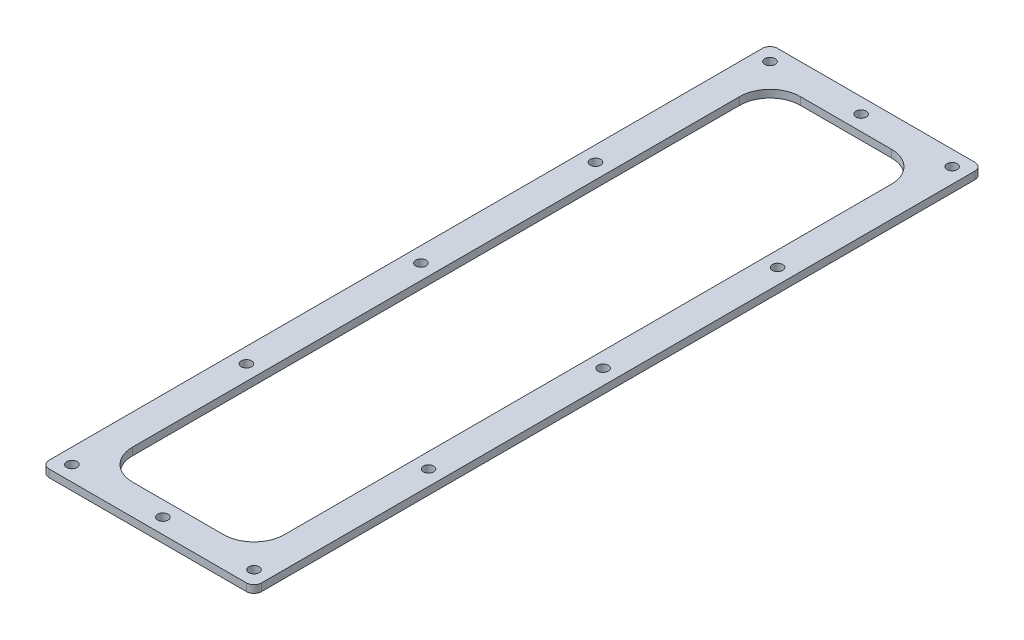
from build123d import *

# Parameters (mm, degrees)
SKETCH1_W           = 88.9
SKETCH1_H           = 304.8
SKETCH1_W_2         = 63.5
SKETCH1_H_2         = 279.4
BOSS_EXTRUDE1_DEPTH = 3.175
SKETCH7_R           = 2.159
CUT_EXTRUDE2_DEPTH  = 159.781746826
FILLET1_R           = 12.7
FILLET3_R           = 3.175


with BuildPart() as part:
    # Sketch1 → Boss-Extrude1 (new body)
    with BuildSketch(Plane(origin=(0, 0, 0), x_dir=(1, 0, 0), z_dir=(0, 1, 0))):
        Rectangle(SKETCH1_W, SKETCH1_H)
        Rectangle(SKETCH1_W_2, SKETCH1_H_2, mode=Mode.SUBTRACT)
    extrude(amount=BOSS_EXTRUDE1_DEPTH)

    # Sketch7 → Cut-Extrude2 (cut, through all)
    with BuildSketch(Plane(origin=(0, 3.175, 0), x_dir=(1, 0, 0), z_dir=(0, 1, 0))):
        with Locations(Location((-38.1, 146.05, 0), (0, 0, 270))):
            Circle(SKETCH7_R)
        with Locations(Location((-38.1, 73.025, 0), (0, 0, 270))):
            Circle(SKETCH7_R)
        with Locations(Location((-38.1, 0, 0), (0, 0, 270))):
            Circle(SKETCH7_R)
        with Locations(Location((-38.1, -73.025, 0), (0, 0, 270))):
            Circle(SKETCH7_R)
        with Locations(Location((-38.1, -146.05, 0), (0, 0, 270))):
            Circle(SKETCH7_R)
        with Locations(Location((38.1, -146.05, 0), (0, 0, 90))):
            Circle(SKETCH7_R)
        with Locations(Location((38.1, -73.025, 0), (0, 0, 90))):
            Circle(SKETCH7_R)
        with Locations(Location((38.1, 0, 0), (0, 0, 90))):
            Circle(SKETCH7_R)
        with Locations(Location((38.1, 73.025, 0), (0, 0, 90))):
            Circle(SKETCH7_R)
        with Locations(Location((38.1, 146.05, 0), (0, 0, 90))):
            Circle(SKETCH7_R)
        with Locations(Location((0, 146.05, 0), (0, 0, 270))):
            Circle(SKETCH7_R)
        with Locations(Location((0, -146.05, 0), (0, 0, 90))):
            Circle(SKETCH7_R)
    extrude(amount=-CUT_EXTRUDE2_DEPTH, mode=Mode.SUBTRACT)

    # Fillet1
    fillet1_edges = [part.edges().sort_by_distance(p)[0] for p in [
        (-31.75, 1.5875, -139.7),
        (-31.75, 1.5875, 139.7),
        (31.75, 1.5875, 139.7),
        (31.75, 1.5875, -139.7),
    ]]
    fillet(fillet1_edges, radius=FILLET1_R)

    # Fillet3
    fillet3_edges = [part.edges().sort_by_distance(p)[0] for p in [
        (-44.45, 1.5875, -152.4),
        (44.45, 1.5875, -152.4),
        (44.45, 1.5875, 152.4),
        (-44.45, 1.5875, 152.4),
    ]]
    fillet(fillet3_edges, radius=FILLET3_R)


solid = part.part
